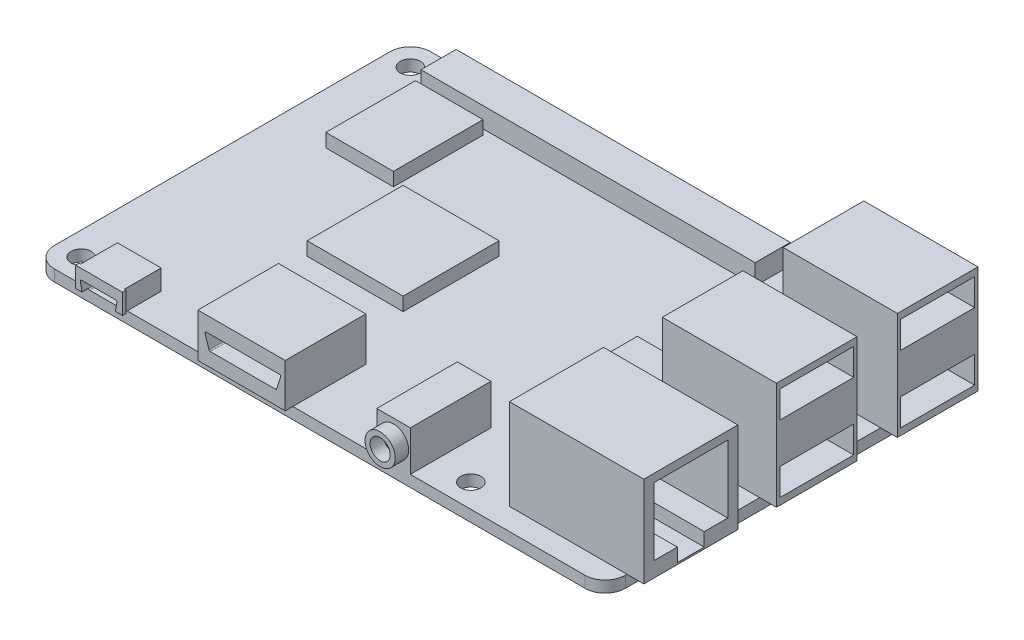
from build123d import *

# Parameters (mm, degrees)
SKETCH1_R            = 3
SKETCH1_R_2          = 1.5
BOSS_EXTRUDE1_DEPTH  = 1.7
SKETCH4_W            = 49.75
SKETCH4_H            = 5.233449475
BOSS_EXTRUDE4_DEPTH  = 3
SKETCH7_W            = 6.5
SKETCH7_H            = 5.5
SKETCH7_W_2          = 7
SKETCH7_H_2          = 0.5
BOSS_EXTRUDE7_DEPTH  = 3
SKETCH8_W            = 13
SKETCH8_H            = 12
BOSS_EXTRUDE8_DEPTH  = 6.5
SKETCH9_W            = 5
SKETCH9_H            = 12
BOSS_EXTRUDE9_DEPTH  = 6
SKETCH10_W           = 20
SKETCH10_H           = 14
BOSS_EXTRUDE10_DEPTH = 13.5
SKETCH11_W           = 17
SKETCH11_H           = 12
BOSS_EXTRUDE11_DEPTH = 16
SKETCH12_W           = 10.053569384
SKETCH12_H           = 13.342225903
SKETCH12_W_2         = 14.279787724
SKETCH12_H_2         = 14.279787724
SKETCH12_W_3         = 9
SKETCH12_H_3         = 9
BOSS_EXTRUDE12_DEPTH = 2
SKETCH13_R           = 2.25
SKETCH13_R_2         = 1.5
BOSS_EXTRUDE13_DEPTH = 2
CUT_EXTRUDE1_DEPTH   = 9
CUT_EXTRUDE2_DEPTH   = 5
SKETCH16_W           = 11
SKETCH16_H           = 4
CUT_EXTRUDE3_DEPTH   = 10
SKETCH17_W           = 11
SKETCH17_H           = 4
CUT_EXTRUDE4_DEPTH   = 10
CUT_EXTRUDE5_DEPTH   = 12


with BuildPart() as part:
    # Sketch1 → Boss-Extrude1 (new body)
    # profile 1 of 5: a face of its own
    with BuildSketch(Plane(origin=(0, 0, 0), x_dir=(1, 0, 0), z_dir=(0, 1, 0))):
        with BuildLine():
            ThreePointArc((39.5, 24.5), (41.621320344, 23.621320344), (42.5, 21.5))
            Line((42.5, 21.5), (42.5, -28.5))
            ThreePointArc((42.5, -28.5), (41.621320344, -30.621320344), (39.5, -31.5))
            Line((39.5, -31.5), (-39.5, -31.5))
            ThreePointArc((-39.5, -31.5), (-41.621320344, -30.621320344), (-42.5, -28.5))
            Line((-42.5, -28.5), (-42.5, 21.5))
            ThreePointArc((-42.5, 21.5), (-41.621320344, 23.621320344), (-39.5, 24.5))
            Line((-39.5, 24.5), (39.5, 24.5))
        make_face()
        with Locations((19, -28)):
            Circle(SKETCH1_R, mode=Mode.SUBTRACT)
        with Locations((19, 21)):
            Circle(SKETCH1_R, mode=Mode.SUBTRACT)
        with Locations((-39, -28)):
            Circle(SKETCH1_R, mode=Mode.SUBTRACT)
        with Locations((-39, 21)):
            Circle(SKETCH1_R, mode=Mode.SUBTRACT)
    # profile 2 of 5: a face of its own
    with BuildSketch(Plane(origin=(0, 0, 0), x_dir=(1, 0, 0), z_dir=(0, 1, 0))):
        with Locations((19, 21)):
            Circle(SKETCH1_R)
        with Locations(Location((19, 21, 0), (0, 0, 270))):
            Circle(SKETCH1_R_2, mode=Mode.SUBTRACT)
    # profile 3 of 5: a face of its own
    with BuildSketch(Plane(origin=(0, 0, 0), x_dir=(1, 0, 0), z_dir=(0, 1, 0))):
        with Locations((-39, 21)):
            Circle(SKETCH1_R)
        with Locations(Location((-39, 21, 0), (0, 0, 270))):
            Circle(SKETCH1_R_2, mode=Mode.SUBTRACT)
    # profile 4 of 5: a face of its own
    with BuildSketch(Plane(origin=(0, 0, 0), x_dir=(1, 0, 0), z_dir=(0, 1, 0))):
        with Locations((-39, -28)):
            Circle(SKETCH1_R)
        with Locations(Location((-39, -28, 0), (0, 0, 270))):
            Circle(SKETCH1_R_2, mode=Mode.SUBTRACT)
    # profile 5 of 5: a face of its own
    with BuildSketch(Plane(origin=(0, 0, 0), x_dir=(1, 0, 0), z_dir=(0, 1, 0))):
        with Locations((19, -28)):
            Circle(SKETCH1_R)
        with Locations(Location((19, -28, 0), (0, 0, 270))):
            Circle(SKETCH1_R_2, mode=Mode.SUBTRACT)
    extrude(amount=BOSS_EXTRUDE1_DEPTH)

    # Sketch4 → Boss-Extrude4 (add)
    with BuildSketch(Plane(origin=(0, 1.7, 0), x_dir=(1, 0, 0), z_dir=(0, 1, 0))):
        with Locations((-10, 21.068102783)):
            Rectangle(SKETCH4_W, SKETCH4_H)
    extrude(amount=BOSS_EXTRUDE4_DEPTH)

    # Sketch7 → Boss-Extrude7 (add)
    with BuildSketch(Plane(origin=(0, 1.7, 0), x_dir=(1, 0, 0), z_dir=(0, 1, 0))):
        with Locations((-31.9, -29.194183223)):
            Rectangle(SKETCH7_W, SKETCH7_H)
        with Locations((-31.9, -32.194183223)):
            Rectangle(SKETCH7_W_2, SKETCH7_H_2)
    extrude(amount=BOSS_EXTRUDE7_DEPTH)

    # Sketch8 → Boss-Extrude8 (add)
    with BuildSketch(Plane(origin=(0, 1.7, 0), x_dir=(1, 0, 0), z_dir=(0, 1, 0))):
        with Locations((-10.5, -26.626453528)):
            Rectangle(SKETCH8_W, SKETCH8_H)
    extrude(amount=BOSS_EXTRUDE8_DEPTH)

    # Sketch9 → Boss-Extrude9 (add)
    with BuildSketch(Plane(origin=(0, 1.7, 0), x_dir=(1, 0, 0), z_dir=(0, 1, 0))):
        with Locations((11, -25.5)):
            Rectangle(SKETCH9_W, SKETCH9_H)
    extrude(amount=BOSS_EXTRUDE9_DEPTH)

    # Sketch10 → Boss-Extrude10 (add)
    with BuildSketch(Plane(origin=(0, 1.7, 0), x_dir=(1, 0, 0), z_dir=(0, 1, 0))):
        with Locations((35, -21.25)):
            Rectangle(SKETCH10_W, SKETCH10_H)
    extrude(amount=BOSS_EXTRUDE10_DEPTH)

    # Sketch11 → Boss-Extrude11 (add)
    with BuildSketch(Plane(origin=(0, 1.7, 0), x_dir=(1, 0, 0), z_dir=(0, 1, 0))):
        with Locations((36.5, -2.5)):
            Rectangle(SKETCH11_W, SKETCH11_H)
        with Locations((36.5, 15.5)):
            Rectangle(SKETCH11_W, SKETCH11_H)
    extrude(amount=BOSS_EXTRUDE11_DEPTH)

    # Sketch12 → Boss-Extrude12 (add)
    with BuildSketch(Plane(origin=(0, 1.7, 0), x_dir=(1, 0, 0), z_dir=(0, 1, 0))):
        with Locations((-29.848215308, 10.97382243)):
            Rectangle(SKETCH12_W, SKETCH12_H)
        with Locations((-15.157331854, -3.918986484)):
            Rectangle(SKETCH12_W_2, SKETCH12_H_2)
        with Locations((19.1, -3.31)):
            Rectangle(SKETCH12_W_3, SKETCH12_H_3)
    extrude(amount=BOSS_EXTRUDE12_DEPTH)

    # Sketch13 → Boss-Extrude13 (add)
    with BuildSketch(Plane.XY.offset(31.5)):
        with Locations(Location((11, 4.7, 0), (0, 0, 180))):
            Circle(SKETCH13_R)
        with Locations((11, 4.7)):
            Circle(SKETCH13_R_2, mode=Mode.SUBTRACT)
    extrude(amount=BOSS_EXTRUDE13_DEPTH)

    # Sketch14 → Cut-Extrude1 (cut)
    with BuildSketch(Plane.XY.offset(32.626453528)):
        with BuildLine():
            Line((-15.750323675, 5.983842352), (-4.86762122, 5.983842352))
            ThreePointArc((-4.86762122, 5.983842352), (-4.705559797, 5.901043441), (-4.677683467, 5.721203306))
            Line((-4.677683467, 5.721203306), (-5.276717124, 3.904778668))
            ThreePointArc((-5.276717124, 3.904778668), (-5.349453787, 3.805356292), (-5.466654877, 3.767417714))
            Line((-5.466654877, 3.767417714), (-15.151290018, 3.767417714))
            ThreePointArc((-15.151290018, 3.767417714), (-15.268491107, 3.805356292), (-15.341227771, 3.904778668))
            Line((-15.341227771, 3.904778668), (-15.940261428, 5.721203306))
            ThreePointArc((-15.940261428, 5.721203306), (-15.912385097, 5.901043441), (-15.750323675, 5.983842352))
        make_face()
    extrude(amount=-CUT_EXTRUDE1_DEPTH, mode=Mode.SUBTRACT)

    # Sketch15 → Cut-Extrude2 (cut)
    with BuildSketch(Plane.XY.offset(32.444183223)):
        with BuildLine():
            Line((-34.475250903, 3.20419671), (-29.43081526, 3.20419671))
            ThreePointArc((-29.43081526, 3.20419671), (-29.27664987, 3.131605628), (-29.234394805, 2.966527034))
            Line((-29.234394805, 2.966527034), (-29.471007813, 1.732759202))
            ThreePointArc((-29.471007813, 1.732759202), (-29.540019351, 1.616263488), (-29.667428269, 1.570428878))
            Line((-29.667428269, 1.570428878), (-34.24114908, 1.570428878))
            ThreePointArc((-34.24114908, 1.570428878), (-34.36870932, 1.616388672), (-34.437643137, 1.733145027))
            Line((-34.437643137, 1.733145027), (-34.67174496, 2.966912859))
            ThreePointArc((-34.67174496, 2.966912859), (-34.62929111, 3.13175695), (-34.475250903, 3.20419671))
        make_face()
    extrude(amount=-CUT_EXTRUDE2_DEPTH, mode=Mode.SUBTRACT)

    # Sketch16 → Cut-Extrude3 (cut)
    with BuildSketch(Plane(origin=(45, 0, 0), x_dir=(0, 0, -1), z_dir=(1, 0, 0))):
        with Locations((-2.5, 4.7)):
            Rectangle(SKETCH16_W, SKETCH16_H)
        with Locations((-2.5, 14.7)):
            Rectangle(SKETCH16_W, SKETCH16_H)
    extrude(amount=-CUT_EXTRUDE3_DEPTH, mode=Mode.SUBTRACT)

    # Sketch17 → Cut-Extrude4 (cut)
    with BuildSketch(Plane(origin=(45, 0, 0), x_dir=(0, 0, -1), z_dir=(1, 0, 0))):
        with Locations((15.5, 14.7)):
            Rectangle(SKETCH17_W, SKETCH17_H)
        with Locations((15.5, 4.7)):
            Rectangle(SKETCH17_W, SKETCH17_H)
    extrude(amount=-CUT_EXTRUDE4_DEPTH, mode=Mode.SUBTRACT)

    # Sketch18 → Cut-Extrude5 (cut)
    with BuildSketch(Plane(origin=(45, 0, 0), x_dir=(0, 0, -1), z_dir=(1, 0, 0))):
        Polygon((-26.75, 14), (-26.75, 3.95), (-23.25, 3.95), (-23.25, 1.95), (-19.25, 1.95), (-19.25, 3.95), (-15.75, 3.95), (-15.75, 14), align=None)
    extrude(amount=-CUT_EXTRUDE5_DEPTH, mode=Mode.SUBTRACT)


solid = part.part
